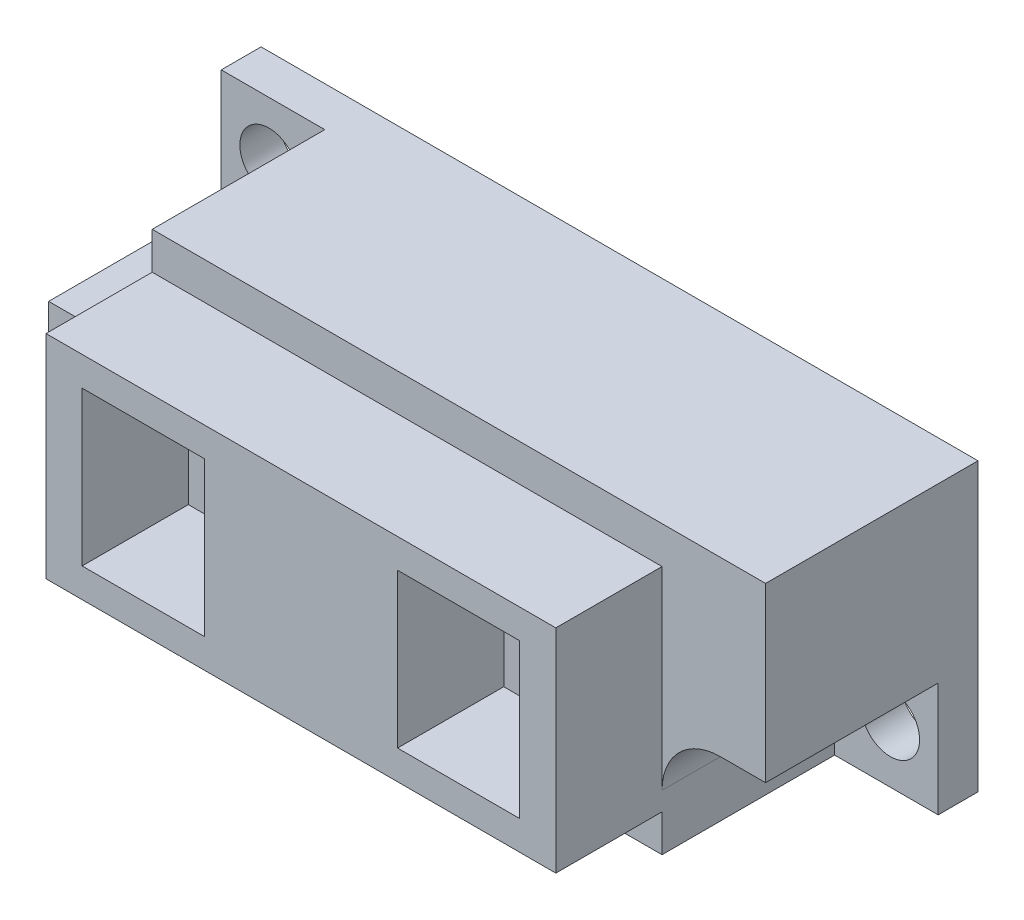
from build123d import *

# Parameters (mm, degrees)
SKETCH1_W                = 27
SKETCH1_H                = 10.8
BOSS_EXTRUDE1_DEPTH      = 12
SKETCH2_R                = 1.1
CUT_EXTRUDE1_DEPTH       = 19.852320812
CUT_EXTRUDE2_DEPTH       = 10.5
SKETCH4_W                = 27
SKETCH4_H                = 10.8
SKETCH4_W_2              = 19.2
SKETCH4_H_2              = 8
CUT_EXTRUDE3_DEPTH       = 4
SKETCH5_W                = 4.6
SKETCH5_H                = 5.8
CUT_EXTRUDE4_DEPTH       = 4
BOSS_EXTRUDE2_DEPTH      = 2.6
BOSS_EXTRUDE2_DEPTH_BACK = 4
SKETCH7_W                = 9.85
SKETCH7_H                = 2.4


with BuildPart() as part:
    # Sketch1 → Boss-Extrude1 (new body)
    with BuildSketch(Plane.XY):
        Rectangle(SKETCH1_W, SKETCH1_H)
    extrude(amount=BOSS_EXTRUDE1_DEPTH)

    # Sketch2 → Cut-Extrude1 (cut, through all)
    with BuildSketch(Plane.XY.offset(12)):
        with Locations((-11.7, 3.3)):
            Circle(SKETCH2_R)
        with Locations((11.7, -3.3)):
            Circle(SKETCH2_R)
    extrude(amount=-CUT_EXTRUDE1_DEPTH, mode=Mode.SUBTRACT)

    # Sketch3 → Cut-Extrude2 (cut)
    with BuildSketch(Plane.XY.offset(12)):
        with BuildLine():
            Line((9.6, -5.4), (9.6, -3.3))
            ThreePointArc((9.6, -3.3), (10.244365081, -1.744365081), (11.8, -1.1))
            Line((11.8, -1.1), (13.5, -1.1))
            Line((13.5, -1.1), (13.5, -5.4))
            Line((13.5, -5.4), (9.6, -5.4))
        make_face()
        with BuildLine():
            Line((-9.6, 5.4), (-9.6, 3.3))
            ThreePointArc((-9.6, 3.3), (-10.244365081, 1.744365081), (-11.8, 1.1))
            Line((-11.8, 1.1), (-13.5, 1.1))
            Line((-13.5, 1.1), (-13.5, 5.4))
            Line((-13.5, 5.4), (-9.6, 5.4))
        make_face()
    extrude(amount=-CUT_EXTRUDE2_DEPTH, mode=Mode.SUBTRACT)

    # Sketch4 → Cut-Extrude3 (cut)
    with BuildSketch(Plane.XY.offset(12)):
        Rectangle(SKETCH4_W, SKETCH4_H)
        Rectangle(SKETCH4_W_2, SKETCH4_H_2, mode=Mode.SUBTRACT)
    extrude(amount=-CUT_EXTRUDE3_DEPTH, mode=Mode.SUBTRACT)

    # Sketch5 → Cut-Extrude4 (cut)
    with BuildSketch(Plane.XY.offset(12)):
        with Locations((-5.94, 0)):
            Rectangle(SKETCH5_W, SKETCH5_H)
        with Locations((5.94, 0)):
            Rectangle(SKETCH5_W, SKETCH5_H)
    extrude(amount=-CUT_EXTRUDE4_DEPTH, mode=Mode.SUBTRACT)

    # Sketch7 → Boss-Extrude2 (add, two sides: drawn at the far end of the back side and taken through both)
    with BuildSketch(Plane(origin=(0, 0, 0), x_dir=(-1, 0, 0), z_dir=(0, 0, -1)).offset(-BOSS_EXTRUDE2_DEPTH_BACK)):
        with Locations((8.575, -6.6)):
            Rectangle(SKETCH7_W, SKETCH7_H)
    extrude(amount=BOSS_EXTRUDE2_DEPTH + BOSS_EXTRUDE2_DEPTH_BACK)


solid = part.part
